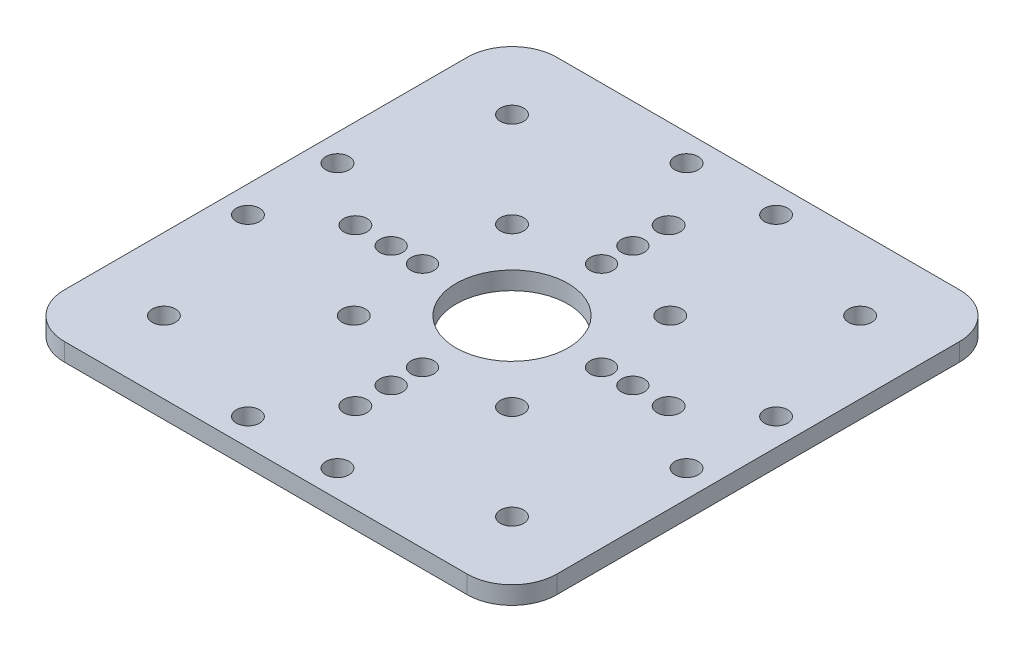
from build123d import *

# Parameters (mm, degrees)
SKETCH_1_W          = 110
SKETCH_1_H          = 110
EXTRUDE_1_DEPTH     = 4
SKETCH_2_R          = 2.6
CUT_EXTRUDE_1_DEPTH = 78.884529914
SKETCH_3_R          = 2.55
CUT_EXTRUDE_2_DEPTH = 78.884529914
SKETCH_4_R          = 2.6
CUT_EXTRUDE_3_DEPTH = 78.884529914
SKETCH_6_R          = 2.6
CUT_EXTRUDE_4_DEPTH = 10
SKETCH_7_R          = 2.6
CUT_EXTRUDE_5_DEPTH = 78.884529914
SKETCH_8_R          = 2.55
CUT_EXTRUDE_6_DEPTH = 78.884529914
SKETCH_9_R          = 12.5
CUT_EXTRUDE_7_DEPTH = 78.884529914
FILLET_1_R          = 10


with BuildPart() as part:
    # 草图1 → 凸台-拉伸1 (new body)
    with BuildSketch(Plane(origin=(0, 0, 0), x_dir=(1, 0, 0), z_dir=(0, 1, 0))):
        Rectangle(SKETCH_1_W, SKETCH_1_H)
    extrude(amount=EXTRUDE_1_DEPTH)

    # 草图2 → 切除-拉伸1 (cut, through all)
    with BuildSketch(Plane(origin=(0, 0, 0), x_dir=(1, 0, 0), z_dir=(0, 1, 0))):
        with Locations(Location((0, 35, 0), (0, 0, 270))):
            Circle(SKETCH_2_R)
        with Locations(Location((35, 0, 0), (0, 0, 270))):
            Circle(SKETCH_2_R)
        with Locations(Location((0, -35, 0), (0, 0, 270))):
            Circle(SKETCH_2_R)
        with Locations(Location((-35, 0, 0), (0, 0, 270))):
            Circle(SKETCH_2_R)
    extrude(amount=CUT_EXTRUDE_1_DEPTH, mode=Mode.SUBTRACT)

    # 草图3 → 切除-拉伸2 (cut, through all)
    with BuildSketch(Plane(origin=(0, 4, 0), x_dir=(1, 0, 0), z_dir=(0, 1, 0))):
        with Locations(Location((0, 27, 0), (0, 0, 270))):
            Circle(SKETCH_3_R)
        with Locations(Location((27, 0, 0), (0, 0, 270))):
            Circle(SKETCH_3_R)
        with Locations(Location((0, -27, 0), (0, 0, 270))):
            Circle(SKETCH_3_R)
        with Locations(Location((-27, 0, 0), (0, 0, 270))):
            Circle(SKETCH_3_R)
    extrude(amount=-CUT_EXTRUDE_2_DEPTH, mode=Mode.SUBTRACT)

    # 草图4 → 切除-拉伸3 (cut, through all)
    with BuildSketch(Plane(origin=(0, 4, 0), x_dir=(1, 0, 0), z_dir=(0, 1, 0))):
        with Locations(Location((-10, 49, 0), (0, 0, 270))):
            Circle(SKETCH_4_R)
        with Locations(Location((10, 49, 0), (0, 0, 270))):
            Circle(SKETCH_4_R)
        with Locations(Location((49, 10, 0), (0, 0, 270))):
            Circle(SKETCH_4_R)
        with Locations(Location((49, -10, 0), (0, 0, 270))):
            Circle(SKETCH_4_R)
        with Locations(Location((10, -49, 0), (0, 0, 270))):
            Circle(SKETCH_4_R)
        with Locations(Location((-10, -49, 0), (0, 0, 270))):
            Circle(SKETCH_4_R)
        with Locations(Location((-49, -10, 0), (0, 0, 270))):
            Circle(SKETCH_4_R)
        with Locations(Location((-49, 10, 0), (0, 0, 270))):
            Circle(SKETCH_4_R)
    extrude(amount=-CUT_EXTRUDE_3_DEPTH, mode=Mode.SUBTRACT)

    # 草图6 → 切除-拉伸4 (cut)
    with BuildSketch(Plane(origin=(0, 4, 0), x_dir=(1, 0, 0), z_dir=(0, 1, 0))):
        with Locations(Location((-38.890872965, 38.890872965, 0), (0, 0, 270))):
            Circle(SKETCH_6_R)
        with Locations(Location((38.890872965, 38.890872965, 0), (0, 0, 270))):
            Circle(SKETCH_6_R)
        with Locations(Location((38.890872965, -38.890872965, 0), (0, 0, 270))):
            Circle(SKETCH_6_R)
        with Locations(Location((-38.890872965, -38.890872965, 0), (0, 0, 270))):
            Circle(SKETCH_6_R)
    extrude(amount=-CUT_EXTRUDE_4_DEPTH, mode=Mode.SUBTRACT)

    # 草图7 → 切除-拉伸5 (cut, through all)
    with BuildSketch(Plane(origin=(0, 4, 0), x_dir=(1, 0, 0), z_dir=(0, 1, 0))):
        with Locations(Location((-17.67766953, 17.67766953, 0), (0, 0, 270))):
            Circle(SKETCH_7_R)
        with Locations(Location((17.67766953, 17.67766953, 0), (0, 0, 270))):
            Circle(SKETCH_7_R)
        with Locations(Location((17.67766953, -17.67766953, 0), (0, 0, 270))):
            Circle(SKETCH_7_R)
        with Locations(Location((-17.67766953, -17.67766953, 0), (0, 0, 270))):
            Circle(SKETCH_7_R)
    extrude(amount=-CUT_EXTRUDE_5_DEPTH, mode=Mode.SUBTRACT)

    # 草图8 → 切除-拉伸6 (cut, through all)
    with BuildSketch(Plane(origin=(0, 4, 0), x_dir=(1, 0, 0), z_dir=(0, 1, 0))):
        with Locations(Location((0, 20, 0), (0, 0, 270))):
            Circle(SKETCH_8_R)
        with Locations(Location((20, 0, 0), (0, 0, 270))):
            Circle(SKETCH_8_R)
        with Locations(Location((0, -20, 0), (0, 0, 270))):
            Circle(SKETCH_8_R)
        with Locations(Location((-20, 0, 0), (0, 0, 270))):
            Circle(SKETCH_8_R)
    extrude(amount=-CUT_EXTRUDE_6_DEPTH, mode=Mode.SUBTRACT)

    # 草图9 → 切除-拉伸7 (cut, through all)
    with BuildSketch(Plane(origin=(0, 4, 0), x_dir=(1, 0, 0), z_dir=(0, 1, 0))):
        with Locations(Location((0, 0, 0), (0, 0, 270))):
            Circle(SKETCH_9_R)
    extrude(amount=-CUT_EXTRUDE_7_DEPTH, mode=Mode.SUBTRACT)

    # 圆角1
    fillet_1_edges = [part.edges().sort_by_distance(p)[0] for p in [
        (55, 2, 55),
        (-55, 2, 55),
        (-55, 2, -55),
        (55, 2, -55),
    ]]
    fillet(fillet_1_edges, radius=FILLET_1_R)


solid = part.part
